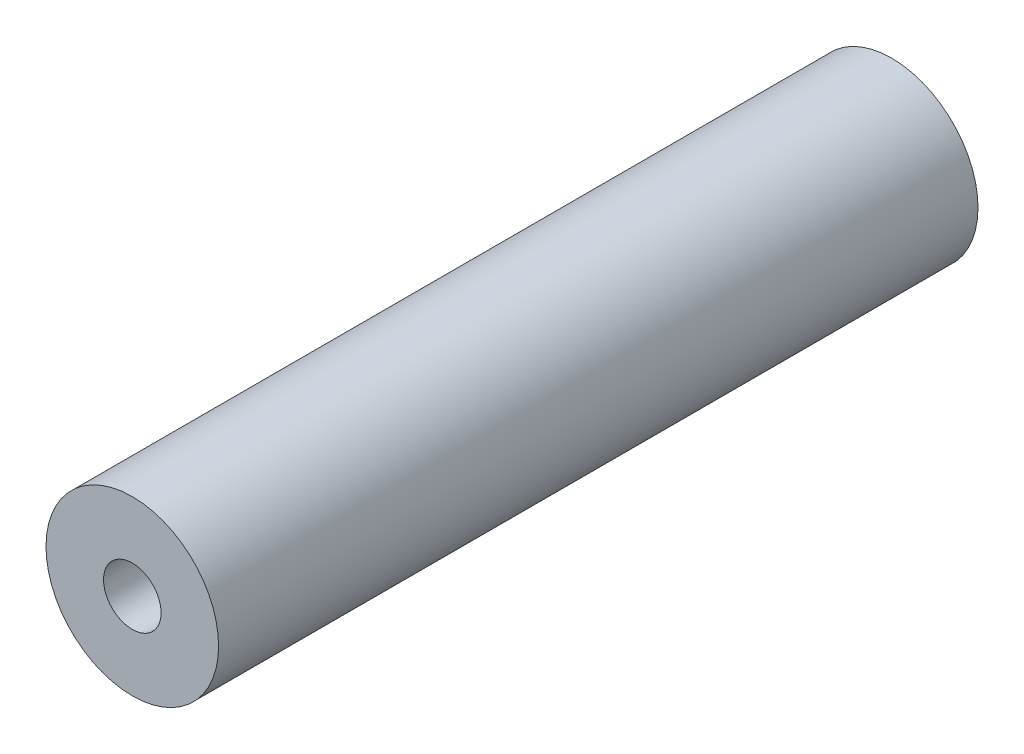
from build123d import *

# Parameters (mm, degrees)
SKETCH1_R             = 7.5
BOSS_EXTRUDE1_DEPTH   = 33
M6_TAPPED_HOLE1_D     = 5
M6_TAPPED_HOLE1_DEPTH = 16
M6_TAPPED_HOLE1_TIP   = 1.502151548
M6_TAPPED_HOLE2_D     = 5
M6_TAPPED_HOLE2_DEPTH = 16
M6_TAPPED_HOLE2_TIP   = 1.502151548


with BuildPart() as part:
    # Sketch1 → Boss-Extrude1 (new, symmetric)
    with BuildSketch(Plane.XY):
        Circle(SKETCH1_R)
    extrude(amount=BOSS_EXTRUDE1_DEPTH, both=True)

    # M6 Tapped Hole1
    with Locations(Plane.XY.offset(33)):
        with Locations((0, 0)):
            Hole(M6_TAPPED_HOLE1_D / 2, depth=M6_TAPPED_HOLE1_DEPTH)
            with Locations((0, 0, -(M6_TAPPED_HOLE1_DEPTH + M6_TAPPED_HOLE1_TIP / 2))):  # 118° drill point
                Cone(0, M6_TAPPED_HOLE1_D / 2, M6_TAPPED_HOLE1_TIP, mode=Mode.SUBTRACT)

    # M6 Tapped Hole2
    with Locations(Plane(origin=(0, 0, -33), x_dir=(-1, 0, 0), z_dir=(0, 0, -1))):
        with Locations((0, 0)):
            Hole(M6_TAPPED_HOLE2_D / 2, depth=M6_TAPPED_HOLE2_DEPTH)
            with Locations((0, 0, -(M6_TAPPED_HOLE2_DEPTH + M6_TAPPED_HOLE2_TIP / 2))):  # 118° drill point
                Cone(0, M6_TAPPED_HOLE2_D / 2, M6_TAPPED_HOLE2_TIP, mode=Mode.SUBTRACT)


solid = part.part
